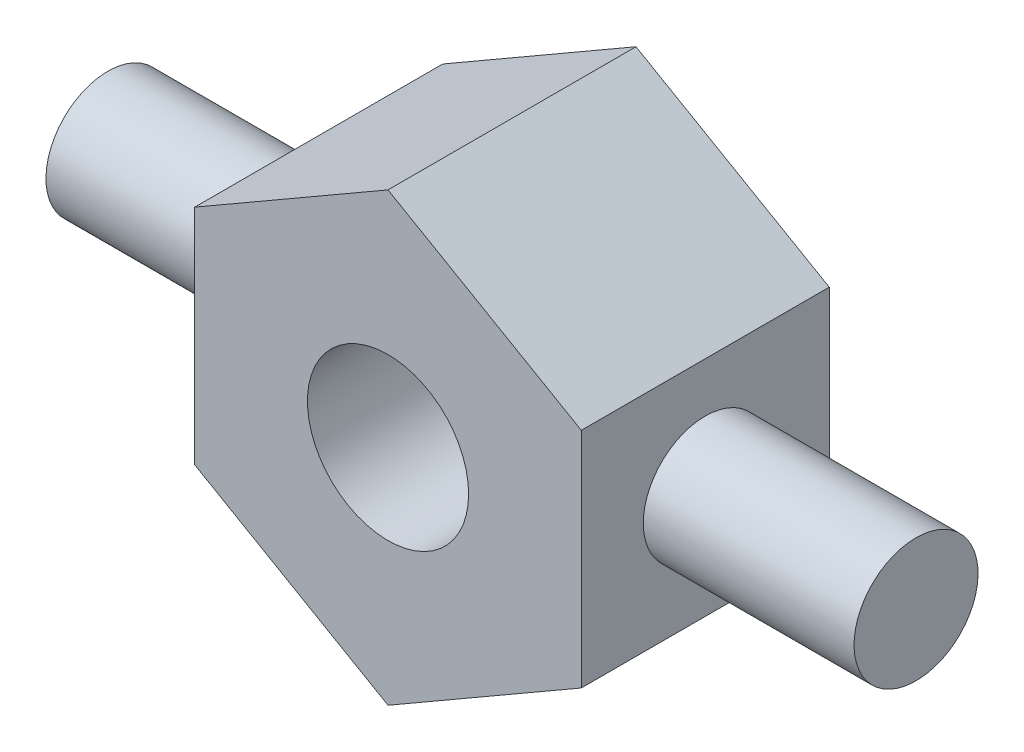
from build123d import *

# Parameters (mm, degrees)
SKETCH1_R           = 32.5
BOSS_EXTRUDE1_DEPTH = 100
SKETCH2_R           = 25
BOSS_EXTRUDE2_DEPTH = 85
BOSS_EXTRUDE3_START = 85
SKETCH3_R           = 25
BOSS_EXTRUDE3_DEPTH = 85


with BuildPart() as part:
    # Sketch1 → Boss-Extrude1 (new body)
    with BuildSketch(Plane.XY):
        Polygon((0, -90), (77.942286341, -45), (77.942286341, 45), (0, 90), (-77.942286341, 45), (-77.942286341, -45), align=None)
        Circle(SKETCH1_R, mode=Mode.SUBTRACT)
    extrude(amount=BOSS_EXTRUDE1_DEPTH)

    # Sketch2 → Boss-Extrude2 (add)
    with BuildSketch(Plane(origin=(77.942286341, 0, 0), x_dir=(0, 0, -1), z_dir=(1, 0, 0))):
        with Locations(Location((-50, 0, 0), (0, 0, 90))):
            Circle(SKETCH2_R)
    extrude(amount=BOSS_EXTRUDE2_DEPTH)

    # Sketch3 → Boss-Extrude3 (add)
    with BuildSketch(Plane.ZY.offset(77.942286341).offset(BOSS_EXTRUDE3_START)):
        with Locations(Location((50, 0, 0), (0, 0, 90))):
            Circle(SKETCH3_R)
    extrude(amount=-BOSS_EXTRUDE3_DEPTH)


solid = part.part
